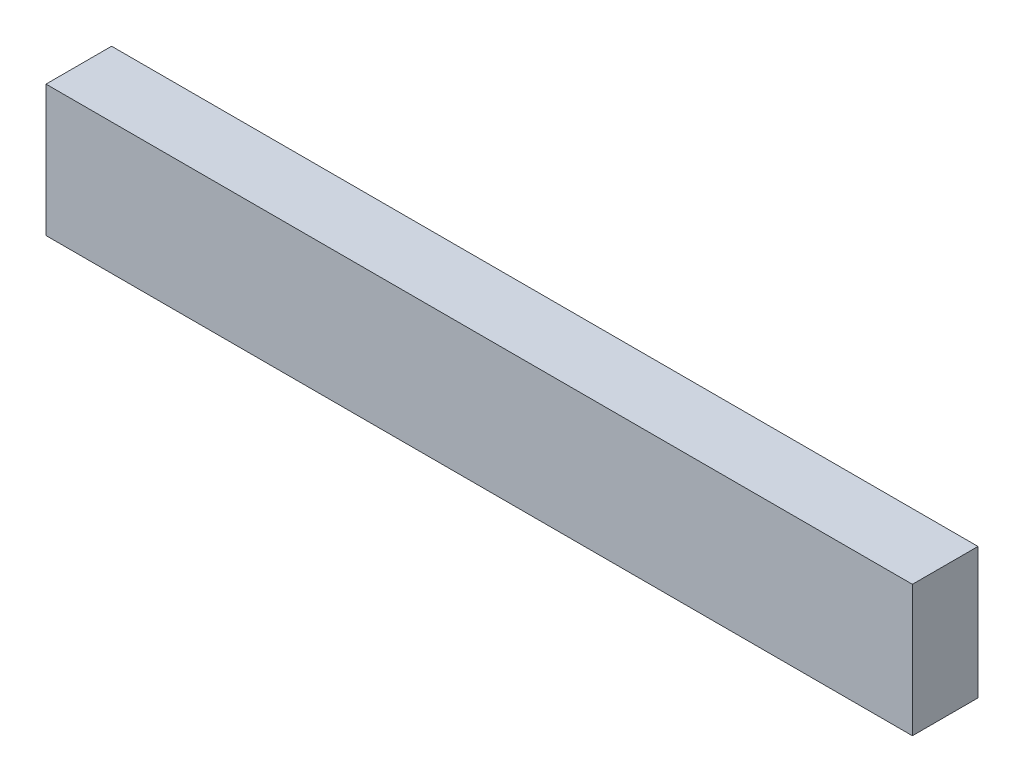
from build123d import *

# Parameters (mm, degrees)
SKETCH1_W           = 1320.8
SKETCH1_H           = 100
BOSS_EXTRUDE1_DEPTH = 200


with BuildPart() as part:
    # Sketch1 → Boss-Extrude1 (new body)
    with BuildSketch(Plane(origin=(0, 0, 0), x_dir=(1, 0, 0), z_dir=(0, 1, 0))):
        with Locations((660.4, 50)):
            Rectangle(SKETCH1_W, SKETCH1_H)
    extrude(amount=BOSS_EXTRUDE1_DEPTH)


solid = part.part
